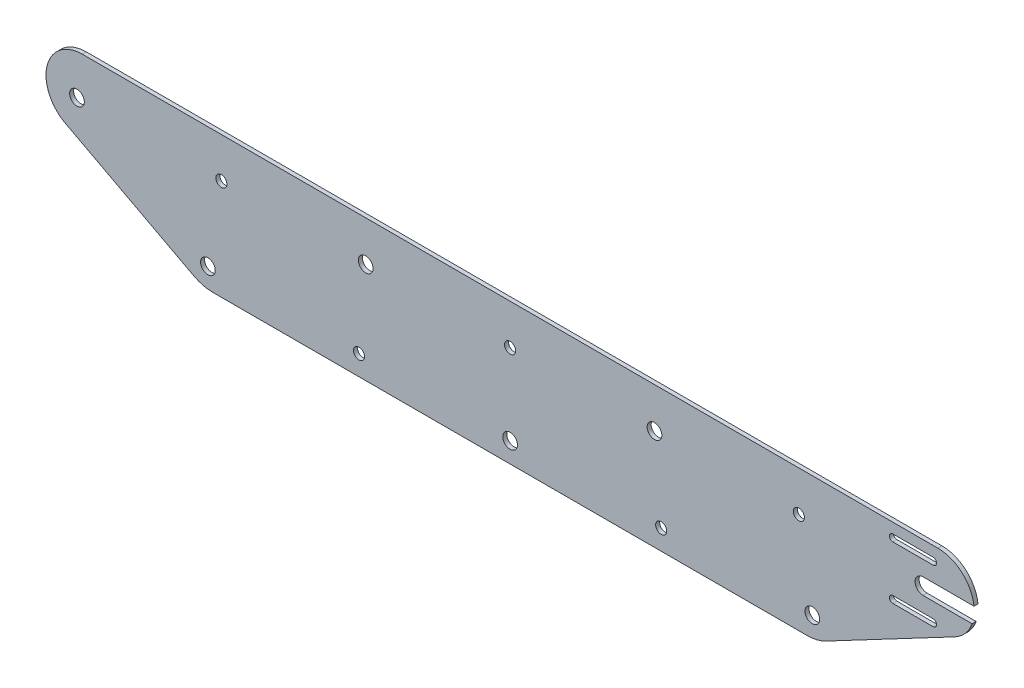
from build123d import *

# Parameters (mm, degrees)
ESQUISSE1_R             = 3.65
BOSS_EXTRU_1_DEPTH      = 2
CONG_1_R                = 18
CONG_2_R                = 20
D_GAGEMENT_M31_D        = 3.4
ENL_V_MAT_EXTRU_1_DEPTH = 234.819122898
D_GAGEMENT_M51_D        = 5.5
D_GAGEMENT_M52_D        = 5.5


with BuildPart() as part:
    # Esquisse1 → Boss.-Extru.1 (new body)
    with BuildSketch(Plane.XY):
        Polygon((-284.958991582, 40), (-150, 40), (150, 40), (284.958991582, 40), (152.479495791, -30), (-152.479495791, -30), align=None)
        with Locations((-215, 20)):
            Circle(ESQUISSE1_R, mode=Mode.SUBTRACT)
        with Locations((-150, -20)):
            Circle(ESQUISSE1_R, mode=Mode.SUBTRACT)
        with Locations((150, -20)):
            Circle(ESQUISSE1_R, mode=Mode.SUBTRACT)
        with Locations((215, 20)):
            Circle(ESQUISSE1_R, mode=Mode.SUBTRACT)
        with Locations((0, -20)):
            Circle(ESQUISSE1_R, mode=Mode.SUBTRACT)
        with Locations((-71.666666667, 20)):
            Circle(ESQUISSE1_R, mode=Mode.SUBTRACT)
        with Locations((71.666666667, 20)):
            Circle(ESQUISSE1_R, mode=Mode.SUBTRACT)
    extrude(amount=BOSS_EXTRU_1_DEPTH)

    # Congé1
    cong_1_edges = [part.edges().sort_by_distance(p)[0] for p in [
        (-284.958991582, 40, 1),
        (284.958991582, 40, 1),
    ]]
    fillet(cong_1_edges, radius=CONG_1_R)

    # Congé2
    cong_2_edges = [part.edges().sort_by_distance(p)[0] for p in [
        (152.479495791, -30, 1),
        (-152.479495791, -30, 1),
    ]]
    fillet(cong_2_edges, radius=CONG_2_R)

    # Dégagement M31 (through all)
    with Locations(Plane(origin=(0, 0, 0), x_dir=(-1, 0, 0), z_dir=(0, 0, -1))):
        with Locations((-200, 33.228756555), (-200, 6.771243445)):
            Hole(D_GAGEMENT_M31_D / 2)

    # Esquisse4 → Enlèv. mat.-Extru.1 (cut, through all)
    with BuildSketch(Plane(origin=(0, 0, 0), x_dir=(-1, 0, 0), z_dir=(0, 0, -1))):
        with BuildLine():
            Line((-229.334149786, 16), (-205, 16))
            ThreePointArc((-205, 16), (-201, 20), (-205, 24))
            Line((-205, 24), (-230.252130857, 24))
            ThreePointArc((-230.252130857, 24), (-230.246241418, 19.948007721), (-229.334149786, 16))
        make_face()
        with BuildLine():
            Line((-210, 31.528756555), (-190, 31.528756555))
            ThreePointArc((-190, 31.528756555), (-188.3, 33.228756555), (-190, 34.928756555))
            Line((-190, 34.928756555), (-210, 34.928756555))
            ThreePointArc((-210, 34.928756555), (-211.7, 33.228756555), (-210, 31.528756555))
        make_face()
        with BuildLine():
            Line((-210, 5.071243445), (-190, 5.071243445))
            ThreePointArc((-190, 5.071243445), (-188.3, 6.771243445), (-190, 8.471243445))
            Line((-190, 8.471243445), (-210, 8.471243445))
            ThreePointArc((-210, 8.471243445), (-211.7, 6.771243445), (-210, 5.071243445))
        make_face()
    extrude(amount=-ENL_V_MAT_EXTRU_1_DEPTH, mode=Mode.SUBTRACT)

    # Dégagement M51 (through all)
    with Locations(Plane(origin=(0, 0, 0), x_dir=(-1, 0, 0), z_dir=(0, 0, -1))):
        with Locations((143.333333333, 20), (0, 20), (-143.333333333, 20)):
            Hole(D_GAGEMENT_M51_D / 2)

    # Dégagement M52 (through all)
    with Locations(Plane.XY.offset(2)):
        with Locations((-75, -20), (75, -20)):
            Hole(D_GAGEMENT_M52_D / 2)


solid = part.part
